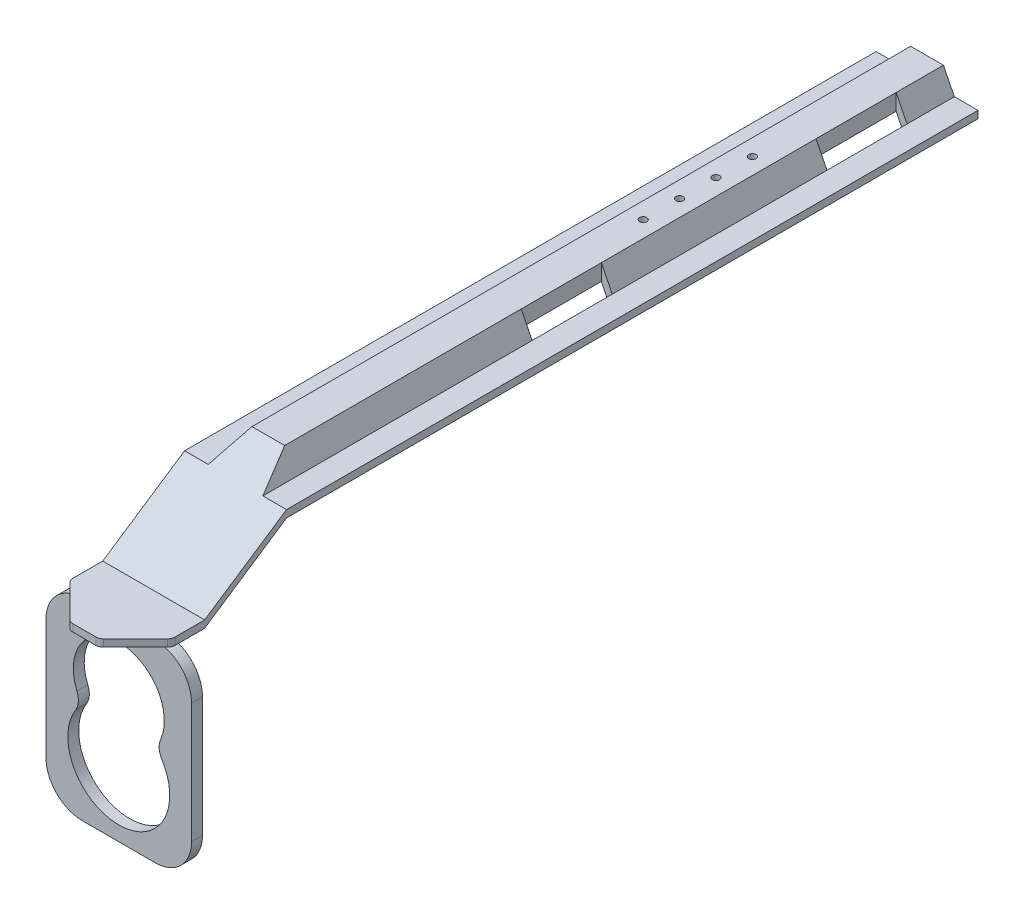
from build123d import *

# Parameters (mm, degrees)
BOSS_EXTRUDE1_DEPTH      = 190
SKETCH3_R                = 1
CUT_EXTRUDE1_DEPTH       = 191.682982985
SKETCH4_W                = 3.000241119
SKETCH4_H                = 22
CUT_EXTRUDE2_DEPTH       = 191.682982985
BOSS_EXTRUDE2_DEPTH      = 14
BOSS_EXTRUDE2_DEPTH_BACK = 14
CHAMFER1_SIZE            = 10
FILLET1_R                = 2
BOSS_EXTRUDE3_DEPTH      = 12.41
SKETCH8_W                = 9.414213562
SKETCH8_H                = 53
CUT_EXTRUDE3_DEPTH       = 245.681494555
CUT_EXTRUDE4_DEPTH       = 244.772504146
CUT_EXTRUDE5_DEPTH       = 243.216914722
FILLET2_R                = 5


with BuildPart() as part:
    # Sketch2 → Boss-Extrude1 (new body)
    with BuildSketch(Plane.XY):
        Polygon((-14, -0.387014685), (-6.26397645, -0.387014685), (-3.263735331, 5.612985315), (3.263735331, 5.612985315), (6.26397645, -0.387014685), (14, -0.387014685), (14, 1.612985315), (7.5, 1.612985315), (4.499758881, 7.612985315), (-4.499758881, 7.612985315), (-7.5, 1.612985315), (-14, 1.612985315), align=None)
    extrude(amount=BOSS_EXTRUDE1_DEPTH)

    # Sketch3 → Cut-Extrude1 (cut, through all)
    with BuildSketch(Plane(origin=(0, 7.612985315, 0), x_dir=(1, 0, 0), z_dir=(0, 1, 0))):
        with Locations(Location((0, -48, 0), (0, 0, 270))):
            Circle(SKETCH3_R)
        with Locations(Location((0, -58, 0), (0, 0, 270))):
            Circle(SKETCH3_R)
        with Locations(Location((0, -68, 0), (0, 0, 270))):
            Circle(SKETCH3_R)
        with Locations(Location((0, -78, 0), (0, 0, 270))):
            Circle(SKETCH3_R)
    extrude(amount=-CUT_EXTRUDE1_DEPTH, mode=Mode.SUBTRACT)

    # Sketch4 → Cut-Extrude2 (cut, through all)
    with BuildSketch(Plane(origin=(0, 7.612985315, 0), x_dir=(1, 0, 0), z_dir=(0, 1, 0))):
        with Locations((-5.999879441, -24)):
            Rectangle(SKETCH4_W, SKETCH4_H)
        with Locations((-5.999879441, -105)):
            Rectangle(SKETCH4_W, SKETCH4_H)
        with Locations((5.999879441, -105)):
            Rectangle(SKETCH4_W, SKETCH4_H)
        with Locations((5.999879441, -24)):
            Rectangle(SKETCH4_W, SKETCH4_H)
    extrude(amount=-CUT_EXTRUDE2_DEPTH, mode=Mode.SUBTRACT)

    # Sketch5 → Boss-Extrude2 (add, two sides: drawn at the far end of the back side and taken through both)
    with BuildSketch(Plane(origin=(0, 0, 0), x_dir=(0, 0, -1), z_dir=(1, 0, 0)).offset(-BOSS_EXTRUDE2_DEPTH_BACK)):
        Polygon((-231.5, -15.387014685), (-212.5, -15.387014685), (-190, -0.387014685), (-178, 7.612985315), (-181, 7.612985315), (-190, 1.612985315), (-212.5, -13.387014685), (-231.5, -13.387014685), align=None)
    extrude(amount=BOSS_EXTRUDE2_DEPTH + BOSS_EXTRUDE2_DEPTH_BACK)

    # Chamfer1
    chamfer1_edges = [part.edges().sort_by_distance(p)[0] for p in [
        (14, -14.387014685, 231.5),
        (-14, -14.387014685, 231.5),
    ]]
    chamfer(chamfer1_edges, length=CHAMFER1_SIZE)

    # Fillet1
    fillet1_edges = [part.edges().sort_by_distance(p)[0] for p in [
        (4, -14.387014685, 231.5),
        (-4, -14.387014685, 231.5),
        (-14, -14.387014685, 221.5),
        (14, -14.387014685, 221.5),
    ]]
    fillet(fillet1_edges, radius=FILLET1_R)

    # Sketch7 → Boss-Extrude3 (add)
    with BuildSketch(Plane.XY.offset(231.5)):
        with BuildLine():
            Line((-10, -68.387014685), (10, -68.387014685))
            ThreePointArc((10, -68.387014685), (17.071067812, -65.458082497), (20, -58.387014685))
            Line((20, -58.387014685), (20, -25.387014685))
            ThreePointArc((20, -25.387014685), (17.071067812, -18.315946873), (10, -15.387014685))
            Line((10, -15.387014685), (-10, -15.387014685))
            ThreePointArc((-10, -15.387014685), (-17.071067812, -18.315946873), (-20, -25.387014685))
            Line((-20, -25.387014685), (-20, -58.387014685))
            ThreePointArc((-20, -58.387014685), (-17.071067812, -65.458082497), (-10, -68.387014685))
        make_face()
        with BuildLine():
            ThreePointArc((10.124631545, -40.717897038), (0, -20.887014685), (-10.124631545, -40.717897038))
            ThreePointArc((-10.124631545, -40.717897038), (0, -64.387014685), (10.124631545, -40.717897038))
        make_face(mode=Mode.SUBTRACT)
    extrude(amount=-BOSS_EXTRUDE3_DEPTH)

    # Sketch8 → Cut-Extrude3 (cut, through all)
    with BuildSketch(Plane(origin=(20, 0, 0), x_dir=(0, 0, -1), z_dir=(1, 0, 0))):
        with Locations((-226.792893219, -41.887014685)):
            Rectangle(SKETCH8_W, SKETCH8_H)
    extrude(amount=-CUT_EXTRUDE3_DEPTH, mode=Mode.SUBTRACT)

    # Sketch9 → Cut-Extrude4 (cut, through all)
    with BuildSketch(Plane(origin=(14, 0, 0), x_dir=(0, 0, -1), z_dir=(1, 0, 0))):
        Polygon((-190, 1.612985315), (-190, 7.612985315), (-181, 7.612985315), align=None)
    extrude(amount=-CUT_EXTRUDE4_DEPTH, mode=Mode.SUBTRACT)

    # Sketch11 → Cut-Extrude5 (cut, through all)
    with BuildSketch(Plane(origin=(0, 0, 0), x_dir=(-1, 0, 0), z_dir=(0, 0, -1))):
        Polygon((14, 7.612985315), (4.499758881, 7.612985315), (7.5, 1.612985315), (14, 1.612985315), align=None)
        Polygon((-14, 1.612985315), (-7.5, 1.612985315), (-4.499758881, 7.612985315), (-14, 7.612985315), align=None)
    extrude(amount=-CUT_EXTRUDE5_DEPTH, mode=Mode.SUBTRACT)

    # Fillet2
    fillet2_edges = [part.edges().sort_by_distance(p)[0] for p in [
        (-10.124631545, -40.717897038, 220.587893219),
        (10.124631545, -40.717897038, 220.587893219),
    ]]
    fillet(fillet2_edges, radius=FILLET2_R)


solid = part.part
